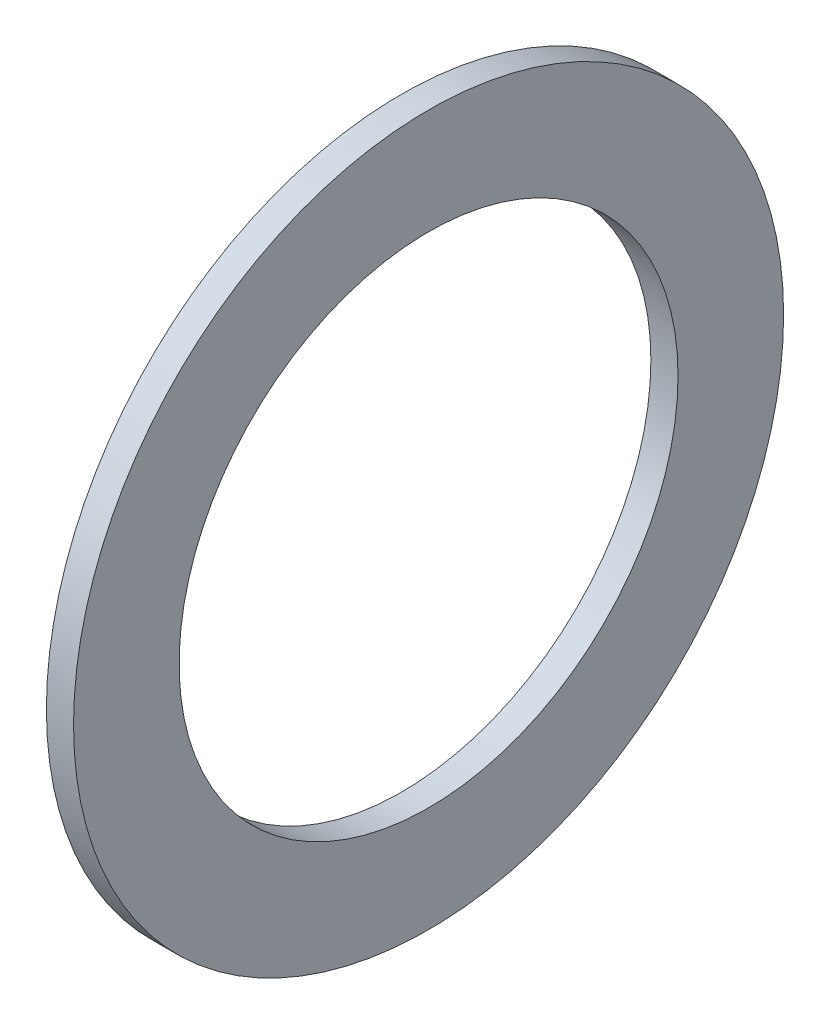
from build123d import *

# Parameters (mm, degrees)
SKETCH1_R           = 17
SKETCH1_R_2         = 11.945
BOSS_EXTRUDE1_DEPTH = 0.65


with BuildPart() as part:
    # Sketch1 → Boss-Extrude1 (new, symmetric)
    with BuildSketch(Plane(origin=(0, 0, 0), x_dir=(0, 0, -1), z_dir=(1, 0, 0))):
        Circle(SKETCH1_R)
        Circle(SKETCH1_R_2, mode=Mode.SUBTRACT)
    extrude(amount=BOSS_EXTRUDE1_DEPTH, both=True)


solid = part.part
